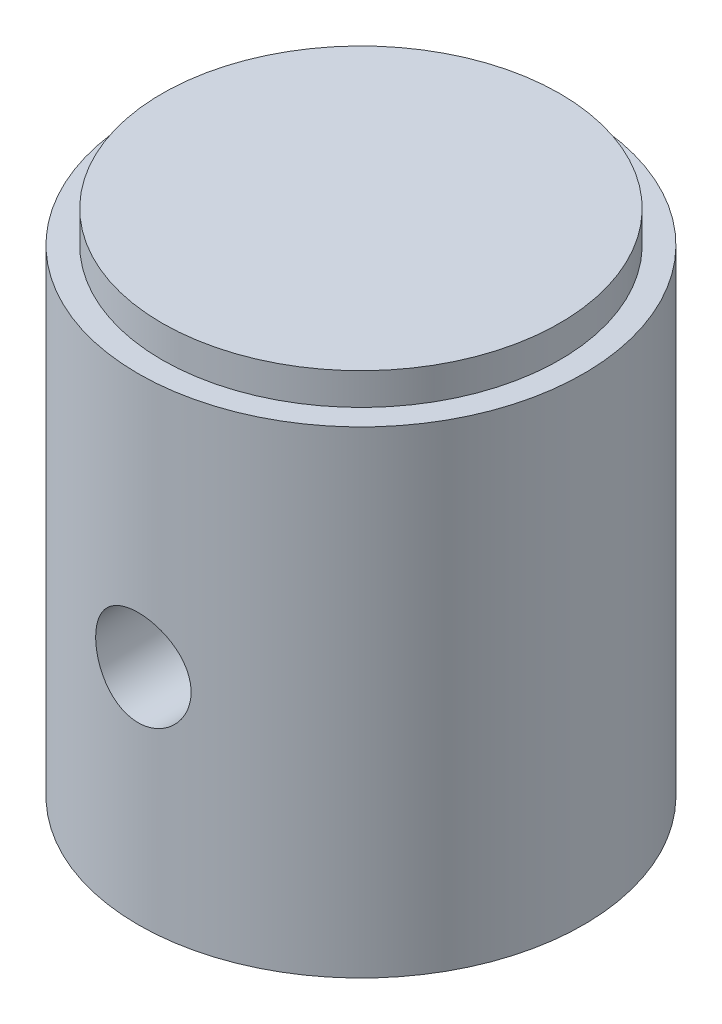
from build123d import *

# Parameters (mm, degrees)
SKETCH1_R               = 7
BOSS_EXTRUDE1_DEPTH     = 16
CUT_EXTRUDE1_DEPTH      = 19.814887722
CUT_EXTRUDE1_DEPTH_BACK = 19.814887722
SKETCH2_R               = 1.5
SKETCH3_R               = 4.75
CUT_EXTRUDE2_DEPTH      = 11
CUT_EXTRUDE3_START      = -1
SKETCH6_R               = 7
SKETCH6_R_2             = 6.25
CUT_EXTRUDE3_DEPTH      = 1


with BuildPart() as part:
    # Sketch1 → Boss-Extrude1 (new body)
    with BuildSketch(Plane(origin=(0, 0, 0), x_dir=(1, 0, 0), z_dir=(0, 1, 0))):
        with Locations(Location((0, 0, 0), (0, 0, 270))):
            Circle(SKETCH1_R)
    extrude(amount=BOSS_EXTRUDE1_DEPTH)

    # Sketch2 → Cut-Extrude1 (cut, two sides: drawn at the far end of the back side and taken through both)
    with BuildSketch(Plane.XY.offset(-CUT_EXTRUDE1_DEPTH_BACK)):
        with Locations(Location((0, 7, 0), (0, 0, 90.000000049))):
            Circle(SKETCH2_R)
    extrude(amount=CUT_EXTRUDE1_DEPTH + CUT_EXTRUDE1_DEPTH_BACK, mode=Mode.SUBTRACT)

    # Sketch3 → Cut-Extrude2 (cut)
    with BuildSketch(Plane.XZ):
        with Locations(Location((0, 0, 0), (0, 0, 270))):
            Circle(SKETCH3_R)
    extrude(amount=-CUT_EXTRUDE2_DEPTH, mode=Mode.SUBTRACT)

    # Sketch4 → Cut-Revolve1 (revolve, cut)
    with BuildSketch(Plane.XY, mode=Mode.PRIVATE) as cut_revolve1_sk:
        Polygon((0, 11), (0, 13.85408794), (4.75, 11), align=None)
    revolve(cut_revolve1_sk.sketch.rotate(Axis((0, 11, 0), (0, 1, 0)), 90), axis=Axis((0, 11, 0), (0, 1, 0)), mode=Mode.SUBTRACT)

    # Sketch5 → Cut-Revolve2 (revolve, cut)
    with BuildSketch(Plane.XY, mode=Mode.PRIVATE) as cut_revolve2_sk:
        Polygon((4.75, 0), (4.75, 3.983842258), (6.2, 0), align=None)
    revolve(cut_revolve2_sk.sketch.rotate(Axis((0, 0, 0), (0, 1, 0)), 90), axis=Axis((0, 0, 0), (0, 1, 0)), mode=Mode.SUBTRACT)

    # Sketch6 → Cut-Extrude3 (cut)
    with BuildSketch(Plane(origin=(0, 16, 0), x_dir=(1, 0, 0), z_dir=(0, 1, 0)).offset(CUT_EXTRUDE3_START)):
        with Locations(Location((0, 0, 0), (0, 0, 270))):
            Circle(SKETCH6_R)
        with Locations(Location((0, 0, 0), (0, 0, 270))):
            Circle(SKETCH6_R_2, mode=Mode.SUBTRACT)
    extrude(amount=CUT_EXTRUDE3_DEPTH, mode=Mode.SUBTRACT)


solid = part.part
